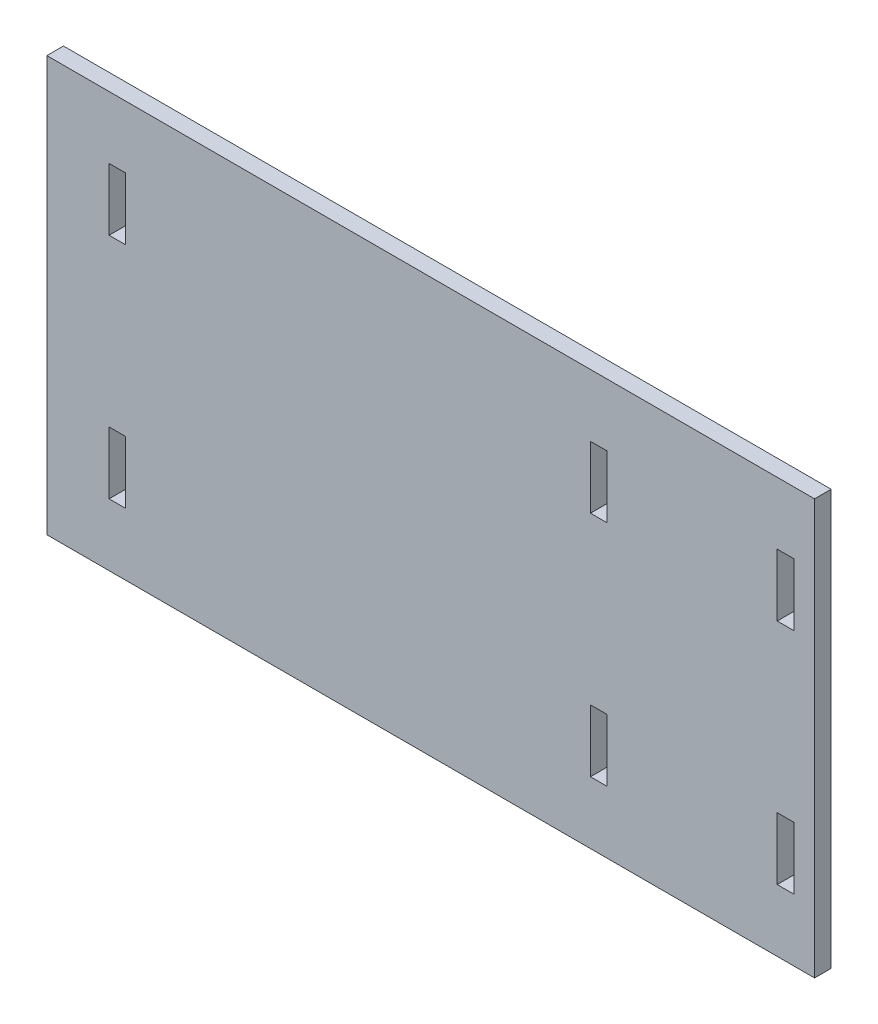
from build123d import *

# Parameters (mm, degrees)
SKETCH1_W           = 4
SKETCH1_H           = 15
BOSS_EXTRUDE1_DEPTH = 4


with BuildPart() as part:
    # Sketch1 → Boss-Extrude1 (new body)
    with BuildSketch(Plane.XY):
        Polygon((-75, -50), (75, -50), (110, -50), (110, 50), (75, 50), (-75, 50), align=None)
        with Locations((58, 27.5)):
            Rectangle(SKETCH1_W, SKETCH1_H, mode=Mode.SUBTRACT)
        with Locations((58, -27.5)):
            Rectangle(SKETCH1_W, SKETCH1_H, mode=Mode.SUBTRACT)
        with Locations((-58, 27.5)):
            Rectangle(SKETCH1_W, SKETCH1_H, mode=Mode.SUBTRACT)
        with Locations((-58, -27.5)):
            Rectangle(SKETCH1_W, SKETCH1_H, mode=Mode.SUBTRACT)
        with Locations((103, 27.5)):
            Rectangle(SKETCH1_W, SKETCH1_H, mode=Mode.SUBTRACT)
        with Locations((103, -27.5)):
            Rectangle(SKETCH1_W, SKETCH1_H, mode=Mode.SUBTRACT)
    extrude(amount=BOSS_EXTRUDE1_DEPTH)


solid = part.part
